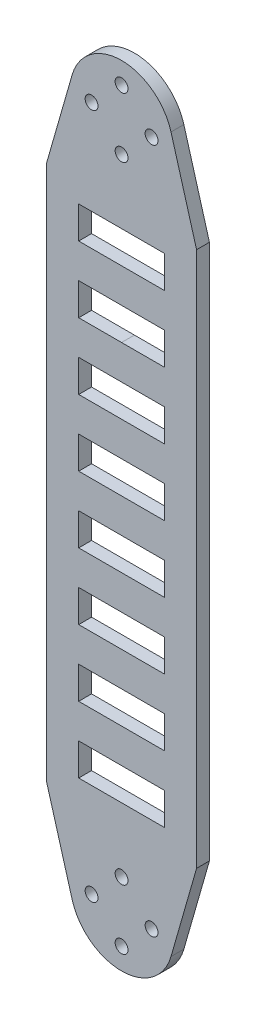
from build123d import *

# Parameters (mm, degrees)
SKETCH1_R           = 1.5
SKETCH1_W           = 20
SKETCH1_H           = 7.5
BOSS_EXTRUDE4_DEPTH = 3


with BuildPart() as part:
    # Sketch1 → Boss-Extrude4 (new body)
    with BuildSketch(Plane.XY):
        with BuildLine():
            Line((-17.5, 142.5), (-17.5, 17.5))
            Line((-17.5, 17.5), (-11.535380853, -3.306809425))
            ThreePointArc((-11.535380853, -3.306809425), (0, -12), (11.535380853, -3.306809425))
            Line((11.535380853, -3.306809425), (17.5, 17.5))
            Line((17.5, 17.5), (17.5, 142.5))
            Line((17.5, 142.5), (11.535380853, 163.306809425))
            ThreePointArc((11.535380853, 163.306809425), (0, 172), (-11.535380853, 163.306809425))
            Line((-11.535380853, 163.306809425), (-17.5, 142.5))
        make_face()
        with Locations((-7, 0)):
            Circle(SKETCH1_R, mode=Mode.SUBTRACT)
        with Locations((0, 25.75)):
            Rectangle(SKETCH1_W, SKETCH1_H, mode=Mode.SUBTRACT)
        with Locations((0, -7)):
            Circle(SKETCH1_R, mode=Mode.SUBTRACT)
        with BuildLine():
            ThreePointArc((0, 8.5), (1.5, 7), (0, 5.5))
            ThreePointArc((0, 5.5), (-1.5, 7), (0, 8.5))
        make_face(mode=Mode.SUBTRACT)
        with Locations((7, 0)):
            Circle(SKETCH1_R, mode=Mode.SUBTRACT)
        with Locations((0, 41.25)):
            Rectangle(SKETCH1_W, SKETCH1_H, mode=Mode.SUBTRACT)
        with Locations((0, 56.75)):
            Rectangle(SKETCH1_W, SKETCH1_H, mode=Mode.SUBTRACT)
        with Locations((0, 72.25)):
            Rectangle(SKETCH1_W, SKETCH1_H, mode=Mode.SUBTRACT)
        with Locations((0, 87.75)):
            Rectangle(SKETCH1_W, SKETCH1_H, mode=Mode.SUBTRACT)
        with Locations((0, 103.25)):
            Rectangle(SKETCH1_W, SKETCH1_H, mode=Mode.SUBTRACT)
        with Locations((0, 118.75)):
            Rectangle(SKETCH1_W, SKETCH1_H, mode=Mode.SUBTRACT)
        with Locations((0, 134.25)):
            Rectangle(SKETCH1_W, SKETCH1_H, mode=Mode.SUBTRACT)
        with Locations((0, 167)):
            Circle(SKETCH1_R, mode=Mode.SUBTRACT)
        with BuildLine():
            ThreePointArc((0, 151.5), (-1.5, 153), (0, 154.5))
            ThreePointArc((0, 154.5), (1.5, 153), (0, 151.5))
        make_face(mode=Mode.SUBTRACT)
        with Locations((-7, 160)):
            Circle(SKETCH1_R, mode=Mode.SUBTRACT)
        with Locations((7, 160)):
            Circle(SKETCH1_R, mode=Mode.SUBTRACT)
    extrude(amount=BOSS_EXTRUDE4_DEPTH)


solid = part.part
